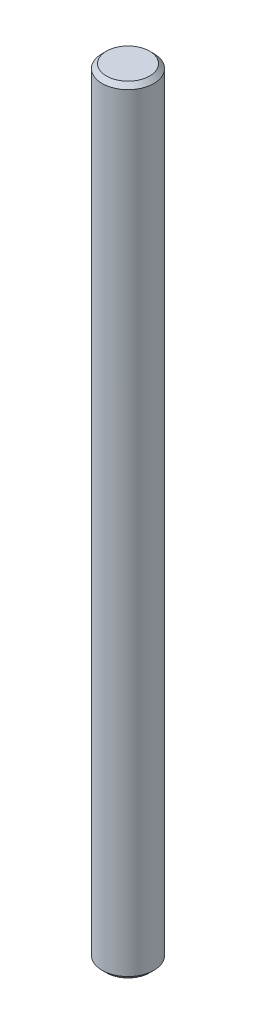
from build123d import *

# Parameters (mm, degrees)
SKETCH1_R           = 3
BOSS_EXTRUDE1_DEPTH = 90
CHAMFER1_SIZE       = 0.5


with BuildPart() as part:
    # Sketch1 → Boss-Extrude1 (new body)
    with BuildSketch(Plane(origin=(0, 0, 0), x_dir=(1, 0, 0), z_dir=(0, 1, 0))):
        with Locations(Location((0, 0, 0), (0, 0, 90))):
            Circle(SKETCH1_R)
    extrude(amount=BOSS_EXTRUDE1_DEPTH)

    # Chamfer1
    chamfer1_edges = [part.edges().sort_by_distance(p)[0] for p in [
        (0, 0, 3),
        (0, 90, 3),
    ]]
    chamfer(chamfer1_edges, length=CHAMFER1_SIZE)


solid = part.part
